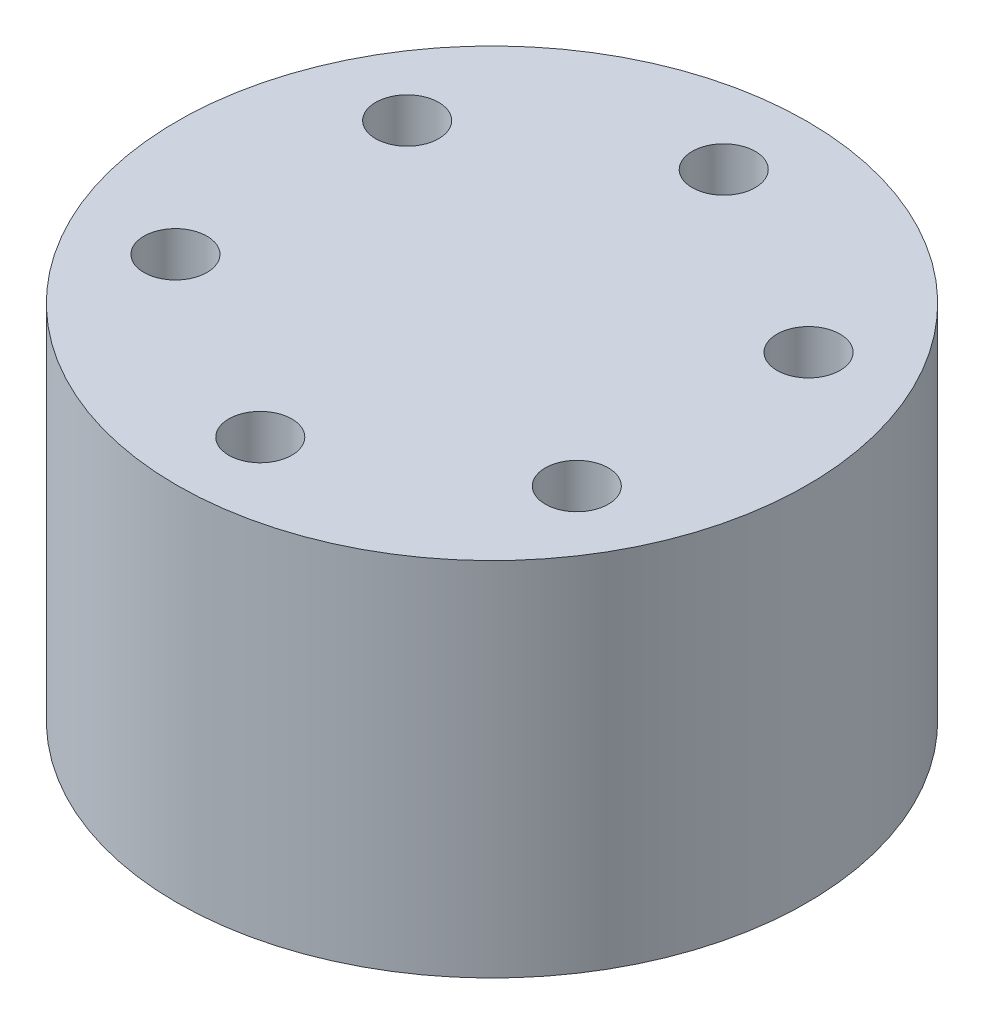
from build123d import *

# Parameters (mm, degrees)
CUBO_START            = 40.25
SK_CUBO_R             = 17
CUBO_DEPTH            = 19.5
PASANTES_M3_START     = 40.25
SK_PASANTES_M3_R      = 1.7
PASANTES_M3_DEPTH     = 19.5
PASADORES_MOTOR_START = 40.25
SK_PASADORES_MOTOR_R  = 2.1
PASADORES_MOTOR_DEPTH = 3.5


with BuildPart() as part:
    # Sk_Cubo → Cubo (new body)
    with BuildSketch(Plane(origin=(0, 0, 0), x_dir=(1, 0, 0), z_dir=(0, 1, 0)).offset(CUBO_START)):
        with Locations(Location((0, -330, 0), (0, 0, 270))):
            Circle(SK_CUBO_R)
    extrude(amount=CUBO_DEPTH)

    # Sk_Pasantes_M3 → Pasantes_M3 (cut)
    with BuildSketch(Plane(origin=(0, 0, 0), x_dir=(1, 0, 0), z_dir=(0, 1, 0)).offset(PASANTES_M3_START)):
        with Locations(Location((10.825317547, -336.25, 0), (0, 0, 270))):
            Circle(SK_PASANTES_M3_R)
        with Locations(Location((0, -342.5, 0), (0, 0, 270))):
            Circle(SK_PASANTES_M3_R)
        with Locations(Location((-10.825317547, -336.25, 0), (0, 0, 270))):
            Circle(SK_PASANTES_M3_R)
        with Locations(Location((-10.825317547, -323.75, 0), (0, 0, 270))):
            Circle(SK_PASANTES_M3_R)
        with Locations(Location((0, -317.5, 0), (0, 0, 270))):
            Circle(SK_PASANTES_M3_R)
        with Locations(Location((10.825317547, -323.75, 0), (0, 0, 270))):
            Circle(SK_PASANTES_M3_R)
    extrude(amount=PASANTES_M3_DEPTH, mode=Mode.SUBTRACT)

    # Sk_Pasadores_motor → Pasadores_motor (cut)
    with BuildSketch(Plane(origin=(0, 0, 0), x_dir=(1, 0, 0), z_dir=(0, 1, 0)).offset(PASADORES_MOTOR_START)):
        with Locations(Location((10.2, -330, 0), (0, 0, 270))):
            Circle(SK_PASADORES_MOTOR_R)
        with Locations(Location((-5.1, -338.833459119, 0), (0, 0, 270))):
            Circle(SK_PASADORES_MOTOR_R)
        with Locations(Location((-5.1, -321.166540881, 0), (0, 0, 270))):
            Circle(SK_PASADORES_MOTOR_R)
    extrude(amount=PASADORES_MOTOR_DEPTH, mode=Mode.SUBTRACT)


solid = part.part
